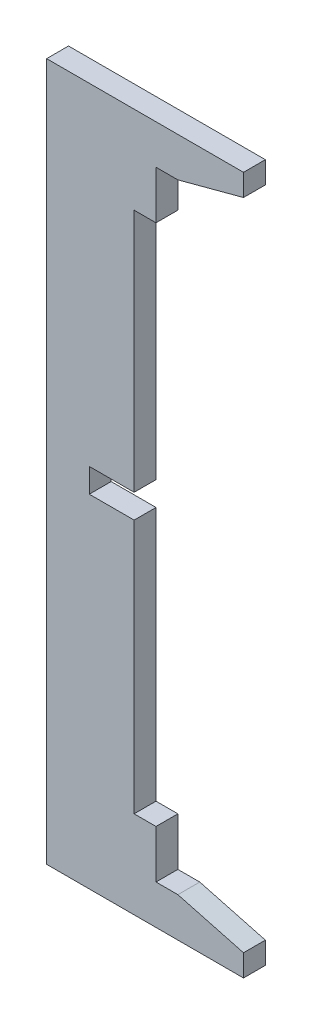
from build123d import *

# Parameters (mm, degrees)
BOSS_EXTRUDE1_DEPTH = 2.5


with BuildPart() as part:
    # Sketch2 → Boss-Extrude1 (new, symmetric)
    with BuildSketch(Plane.XY):
        Polygon((-366.252975542, -70.079481859), (-376.502975542, -70.079481859), (-376.502975542, -75.579481859), (-366.252975542, -75.579481859), (-366.252975542, -133.729086599), (-361.252975542, -133.729086599), (-361.252975542, -144.729086599), (-356.252975542, -144.729086599), (-341.252975542, -148.729086599), (-341.252975542, -153.729086599), (-386.252975542, -153.729086599), (-386.252975542, 5.770882486), (-341.252975542, 5.770882486), (-341.252975542, 0.770882486), (-356.252975542, -3.229117514), (-361.252975542, -3.229117514), (-361.252975542, -14.229117514), (-366.252975542, -14.229117514), align=None)
    extrude(amount=BOSS_EXTRUDE1_DEPTH, both=True)


solid = part.part
